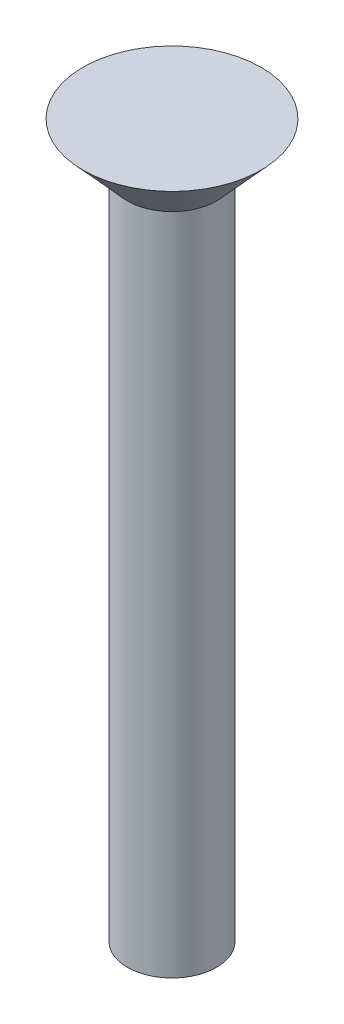
from build123d import *


with BuildPart() as part:
    # Esquisse1 → Révolution1 (revolve)
    with BuildSketch(Plane.XY, mode=Mode.PRIVATE) as r_volution1_sk:
        Polygon((0, -35.145631068), (5, -35.145631068), (5, 39.354368932), (10, 44.854368932), (0, 44.854368932), align=None)
    revolve(r_volution1_sk.sketch.rotate(Axis((0, 44.854368932, 0), (0, -1, 0)), 90), axis=Axis((0, 44.854368932, 0), (0, -1, 0)))


solid = part.part
